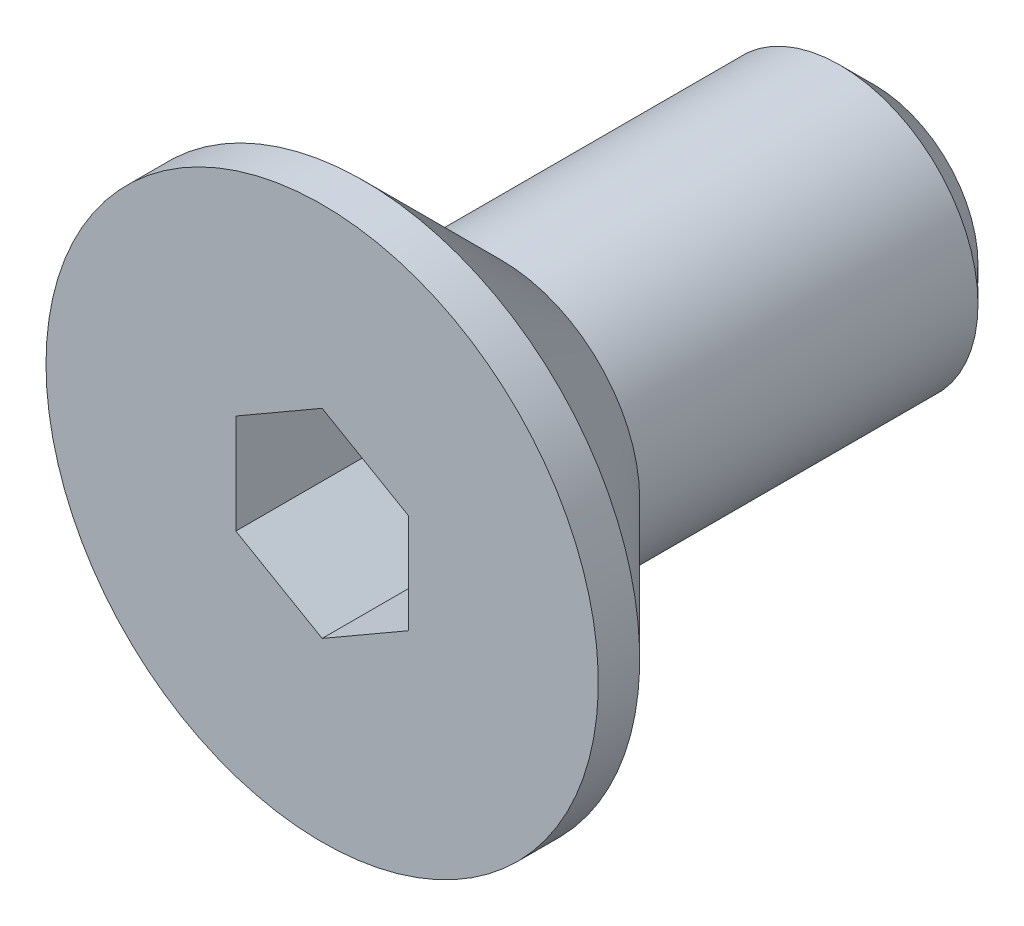
from build123d import *

# Parameters (mm, degrees)
CHAMFER_1_SIZE      = 0.5
CUT_EXTRUDE_1_DEPTH = 2.5


with BuildPart() as part:
    # 草图1 → 旋转1 (revolve)
    with BuildSketch(Plane(origin=(0, 0, 0), x_dir=(0, 0, -1), z_dir=(1, 0, 0)), mode=Mode.PRIVATE) as revolve_1_sk:
        Polygon((-4, 0), (-4, 4), (-3.4, 4), (-1.4, 2), (4, 2), (4, 0), align=None)
    revolve(revolve_1_sk.sketch.rotate(Axis((0, 0, -4), (0, 0, 1)), 90), axis=Axis((0, 0, -4), (0, 0, 1)))

    # 倒角1
    chamfer_1_edges = [part.edges().sort_by_distance(p)[0] for p in [
        (2, 0, -4),
    ]]
    chamfer(chamfer_1_edges, length=CHAMFER_1_SIZE)

    # 草图2 → 切除-拉伸1 (cut)
    with BuildSketch(Plane.XY.offset(4)):
        Polygon((0, 1.443375673), (-1.25, 0.721687836), (-1.25, -0.721687836), (0, -1.443375673), (1.25, -0.721687836), (1.25, 0.721687836), align=None)
    extrude(amount=-CUT_EXTRUDE_1_DEPTH, mode=Mode.SUBTRACT)


solid = part.part
